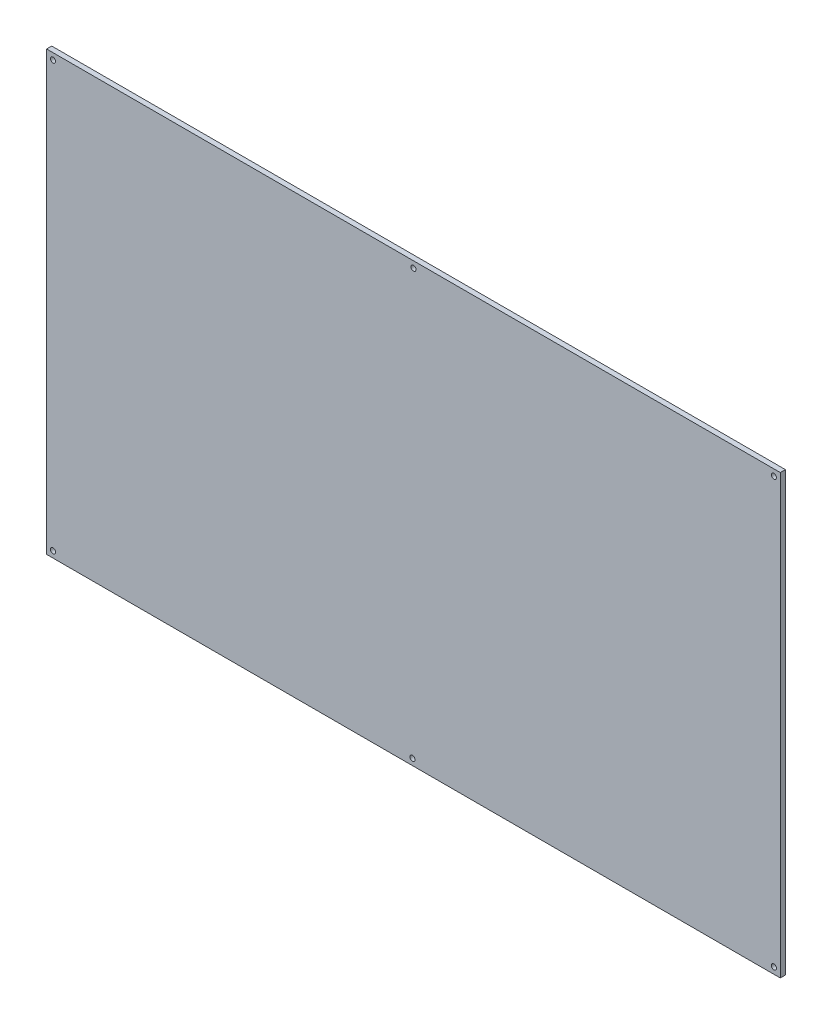
from build123d import *

# Parameters (mm, degrees)
ESQUISSE1_W        = 286.8
ESQUISSE1_H        = 171.11
ESQUISSE1_R        = 1
BOSS_EXTRU_1_DEPTH = 2


with BuildPart() as part:
    # Esquisse1 → Boss.-Extru.1 (new body)
    with BuildSketch(Plane.XY):
        with Locations((99.626517238, -66.069008859)):
            Rectangle(ESQUISSE1_W, ESQUISSE1_H)
        with Locations((-41.273482762, 16.985991141)):
            Circle(ESQUISSE1_R, mode=Mode.SUBTRACT)
        with Locations((-41.273482762, -149.124008859)):
            Circle(ESQUISSE1_R, mode=Mode.SUBTRACT)
        with Locations((240.526517238, 16.985991141)):
            Circle(ESQUISSE1_R, mode=Mode.SUBTRACT)
        with Locations((240.526517238, -149.124008859)):
            Circle(ESQUISSE1_R, mode=Mode.SUBTRACT)
        with Locations((99.626517238, 16.985991141)):
            Circle(ESQUISSE1_R, mode=Mode.SUBTRACT)
        with Locations((99.244103399, -149.124008859)):
            Circle(ESQUISSE1_R, mode=Mode.SUBTRACT)
    extrude(amount=BOSS_EXTRU_1_DEPTH)


solid = part.part
